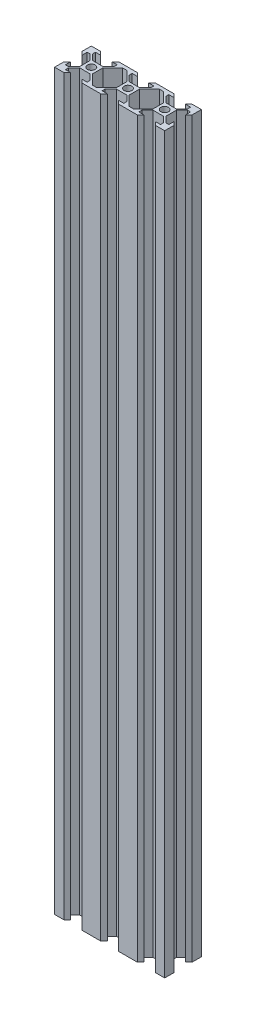
from build123d import *

# Parameters (mm, degrees)
EXTRUDE_1_DEPTH = 400


with BuildPart() as part:
    # 草图1 → 凸台-拉伸1 (new body)
    with BuildSketch(Plane(origin=(0, 0, 0), x_dir=(1, 0, 0), z_dir=(0, 1, 0))):
        with BuildLine():
            Line((-3.476396103, 2.84), (-3.476396103, 0))
            Line((-3.476396103, 0), (-2.1, 0))
            ThreePointArc((-2.1, 0), (-1.48492424, 1.48492424), (0, 2.1))
            Line((0, 2.1), (0, 3.476396103))
            Line((0, 3.476396103), (-2.84, 3.476396103))
            Line((-2.84, 3.476396103), (-5.923603897, 6.56))
            Line((-5.923603897, 6.56), (-5.923603897, 8.2))
            Line((-5.923603897, 8.2), (-3.1, 8.2))
            Line((-3.1, 8.2), (-4.9, 10))
            Line((-4.9, 10), (-10, 10))
            Line((-10, 10), (-10, 4.9))
            Line((-10, 4.9), (-8.2, 3.1))
            Line((-8.2, 3.1), (-8.2, 5.923603897))
            Line((-8.2, 5.923603897), (-6.56, 5.923603897))
            Line((-6.56, 5.923603897), (-3.476396103, 2.84))
        make_face()
        with BuildLine():
            Line((-2.1, 0), (-3.476396103, 0))
            Line((-3.476396103, 0), (-3.476396103, -2.84))
            Line((-3.476396103, -2.84), (-6.56, -5.923603897))
            Line((-6.56, -5.923603897), (-8.2, -5.923603897))
            Line((-8.2, -5.923603897), (-8.2, -3.1))
            Line((-8.2, -3.1), (-10, -4.9))
            Line((-10, -4.9), (-10, -10))
            Line((-10, -10), (-4.9, -10))
            Line((-4.9, -10), (-3.1, -8.2))
            Line((-3.1, -8.2), (-5.923603897, -8.2))
            Line((-5.923603897, -8.2), (-5.923603897, -6.56))
            Line((-5.923603897, -6.56), (-2.84, -3.476396103))
            Line((-2.84, -3.476396103), (0, -3.476396103))
            Line((0, -3.476396103), (0, -2.1))
            ThreePointArc((0, -2.1), (-1.48492424, -1.48492424), (-2.1, 0))
        make_face()
        with BuildLine():
            ThreePointArc((2.1, 0), (1.48492424, -1.48492424), (0, -2.1))
            Line((0, -2.1), (0, -3.476396103))
            Line((0, -3.476396103), (2.84, -3.476396103))
            Line((2.84, -3.476396103), (5.923603897, -6.56))
            Line((5.923603897, -6.56), (5.923603897, -8.2))
            Line((5.923603897, -8.2), (3.1, -8.2))
            Line((3.1, -8.2), (4.9, -10))
            Line((4.9, -10), (15.1, -10))
            Line((15.1, -10), (16.9, -8.2))
            Line((16.9, -8.2), (14.076396103, -8.2))
            Line((14.076396103, -8.2), (14.076396103, -6.56))
            Line((14.076396103, -6.56), (17.16, -3.476396103))
            Line((17.16, -3.476396103), (20, -3.476396103))
            Line((20, -3.476396103), (20, -2.1))
            ThreePointArc((20, -2.1), (18.51507576, -1.48492424), (17.9, 0))
            Line((17.9, 0), (16.523603897, 0))
            Line((16.523603897, 0), (16.523603897, -2.84))
            Line((16.523603897, -2.84), (13.44, -5.923603897))
            Line((13.44, -5.923603897), (11.163603897, -8.2))
            Line((11.163603897, -8.2), (8.836396103, -8.2))
            Line((8.836396103, -8.2), (6.56, -5.923603897))
            Line((6.56, -5.923603897), (3.476396103, -2.84))
            Line((3.476396103, -2.84), (3.476396103, 0))
            Line((3.476396103, 0), (2.1, 0))
        make_face()
        with BuildLine():
            Line((0, 3.476396103), (0, 2.1))
            ThreePointArc((0, 2.1), (1.48492424, 1.48492424), (2.1, 0))
            Line((2.1, 0), (3.476396103, 0))
            Line((3.476396103, 0), (3.476396103, 2.84))
            Line((3.476396103, 2.84), (6.56, 5.923603897))
            Line((6.56, 5.923603897), (8.836396103, 8.2))
            Line((8.836396103, 8.2), (11.163603897, 8.2))
            Line((11.163603897, 8.2), (13.44, 5.923603897))
            Line((13.44, 5.923603897), (16.523603897, 2.84))
            Line((16.523603897, 2.84), (16.523603897, 0))
            Line((16.523603897, 0), (17.9, 0))
            ThreePointArc((17.9, 0), (18.51507576, 1.48492424), (20, 2.1))
            Line((20, 2.1), (20, 3.476396103))
            Line((20, 3.476396103), (17.16, 3.476396103))
            Line((17.16, 3.476396103), (14.076396103, 6.56))
            Line((14.076396103, 6.56), (14.076396103, 8.2))
            Line((14.076396103, 8.2), (16.9, 8.2))
            Line((16.9, 8.2), (15.1, 10))
            Line((15.1, 10), (4.9, 10))
            Line((4.9, 10), (3.1, 8.2))
            Line((3.1, 8.2), (5.923603897, 8.2))
            Line((5.923603897, 8.2), (5.923603897, 6.56))
            Line((5.923603897, 6.56), (2.84, 3.476396103))
            Line((2.84, 3.476396103), (0, 3.476396103))
        make_face()
        with BuildLine():
            Line((20, 3.476396103), (20, 2.1))
            ThreePointArc((20, 2.1), (21.48492424, 1.48492424), (22.1, 0))
            Line((22.1, 0), (23.476396103, 0))
            Line((23.476396103, 0), (23.476396103, 2.84))
            Line((23.476396103, 2.84), (26.56, 5.923603897))
            Line((26.56, 5.923603897), (28.836396103, 8.2))
            Line((28.836396103, 8.2), (31.163603897, 8.2))
            Line((31.163603897, 8.2), (33.44, 5.923603897))
            Line((33.44, 5.923603897), (36.523603897, 2.84))
            Line((36.523603897, 2.84), (36.523603897, 0))
            Line((36.523603897, 0), (37.9, 0))
            ThreePointArc((37.9, 0), (40, 2.1), (42.1, 0))
            Line((42.1, 0), (43.476396103, 0))
            Line((43.476396103, 0), (43.476396103, 2.84))
            Line((43.476396103, 2.84), (46.56, 5.923603897))
            Line((46.56, 5.923603897), (48.2, 5.923603897))
            Line((48.2, 5.923603897), (48.2, 3.1))
            Line((48.2, 3.1), (50, 4.9))
            Line((50, 4.9), (50, 10))
            Line((50, 10), (44.9, 10))
            Line((44.9, 10), (43.1, 8.2))
            Line((43.1, 8.2), (45.923603897, 8.2))
            Line((45.923603897, 8.2), (45.923603897, 6.56))
            Line((45.923603897, 6.56), (42.84, 3.476396103))
            Line((42.84, 3.476396103), (37.16, 3.476396103))
            Line((37.16, 3.476396103), (34.076396103, 6.56))
            Line((34.076396103, 6.56), (34.076396103, 8.2))
            Line((34.076396103, 8.2), (36.9, 8.2))
            Line((36.9, 8.2), (35.1, 10))
            Line((35.1, 10), (24.9, 10))
            Line((24.9, 10), (23.1, 8.2))
            Line((23.1, 8.2), (25.923603897, 8.2))
            Line((25.923603897, 8.2), (25.923603897, 6.56))
            Line((25.923603897, 6.56), (22.84, 3.476396103))
            Line((22.84, 3.476396103), (20, 3.476396103))
        make_face()
        with BuildLine():
            ThreePointArc((22.1, 0), (21.48492424, -1.48492424), (20, -2.1))
            Line((20, -2.1), (20, -3.476396103))
            Line((20, -3.476396103), (22.84, -3.476396103))
            Line((22.84, -3.476396103), (25.923603897, -6.56))
            Line((25.923603897, -6.56), (25.923603897, -8.2))
            Line((25.923603897, -8.2), (23.1, -8.2))
            Line((23.1, -8.2), (24.9, -10))
            Line((24.9, -10), (35.1, -10))
            Line((35.1, -10), (36.9, -8.2))
            Line((36.9, -8.2), (34.076396103, -8.2))
            Line((34.076396103, -8.2), (34.076396103, -6.56))
            Line((34.076396103, -6.56), (37.16, -3.476396103))
            Line((37.16, -3.476396103), (42.84, -3.476396103))
            Line((42.84, -3.476396103), (45.923603897, -6.56))
            Line((45.923603897, -6.56), (45.923603897, -8.2))
            Line((45.923603897, -8.2), (43.1, -8.2))
            Line((43.1, -8.2), (44.9, -10))
            Line((44.9, -10), (50, -10))
            Line((50, -10), (50, -4.9))
            Line((50, -4.9), (48.2, -3.1))
            Line((48.2, -3.1), (48.2, -5.923603897))
            Line((48.2, -5.923603897), (46.56, -5.923603897))
            Line((46.56, -5.923603897), (43.476396103, -2.84))
            Line((43.476396103, -2.84), (43.476396103, 0))
            Line((43.476396103, 0), (42.1, 0))
            ThreePointArc((42.1, 0), (40, -2.1), (37.9, 0))
            Line((37.9, 0), (36.523603897, 0))
            Line((36.523603897, 0), (36.523603897, -2.84))
            Line((36.523603897, -2.84), (33.44, -5.923603897))
            Line((33.44, -5.923603897), (31.163603897, -8.2))
            Line((31.163603897, -8.2), (28.836396103, -8.2))
            Line((28.836396103, -8.2), (26.56, -5.923603897))
            Line((26.56, -5.923603897), (23.476396103, -2.84))
            Line((23.476396103, -2.84), (23.476396103, 0))
            Line((23.476396103, 0), (22.1, 0))
        make_face()
    extrude(amount=EXTRUDE_1_DEPTH)


solid = part.part
